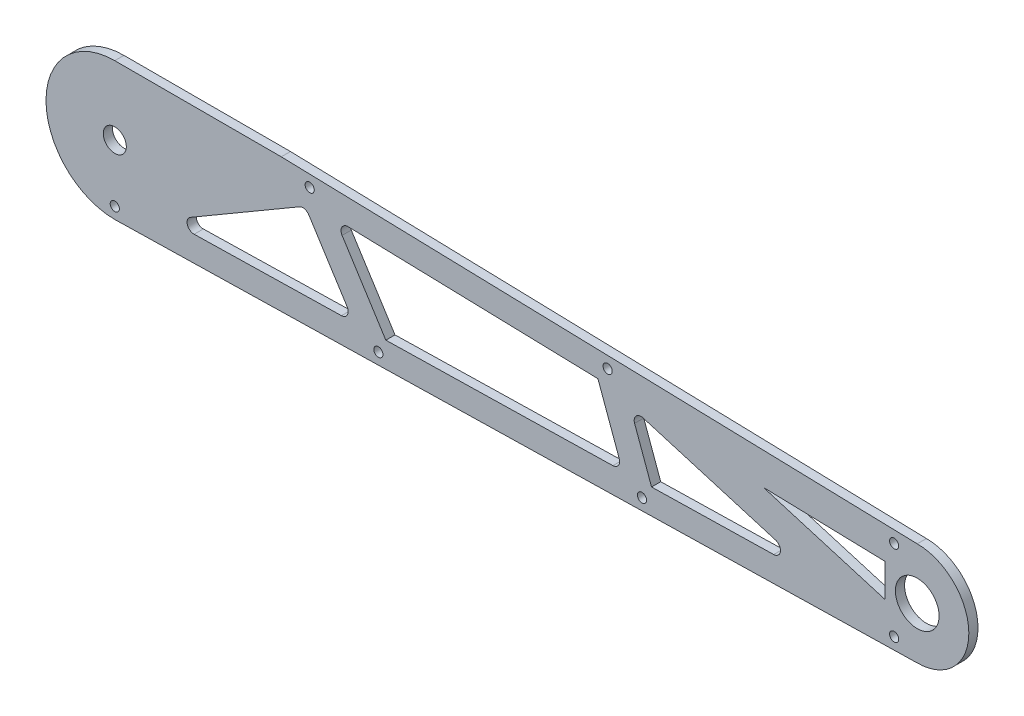
from build123d import *

# Parameters (mm, degrees)
SKETCH_1_R          = 5.03
SKETCH_1_R_2        = 9.53
SKETCH_1_R_3        = 2
EXTRUDE_1_DEPTH     = 4
CUT_EXTRUDE_1_DEPTH = 10


with BuildPart() as part:
    # 草图1 → 凸台-拉伸1 (new body)
    with BuildSketch(Plane.XY):
        with BuildLine():
            Line((348.542857143, 22.354285714), (71.15327348, 29.854285714))
            Line((71.15327348, 29.854285714), (-1.457142857, 29.854285714))
            ThreePointArc((-1.457142857, 29.854285714), (-31.457142857, -0.145714286), (-1.457142857, -30.145714286))
            Line((-1.457142857, -30.145714286), (348.542857143, -22.645714286))
            ThreePointArc((348.542857143, -22.645714286), (371.042857143, -0.145714286), (348.542857143, 22.354285714))
        make_face()
        with Locations((-1.457142857, -0.145714286)):
            Circle(SKETCH_1_R, mode=Mode.SUBTRACT)
        with Locations((348.542857143, -0.145714286)):
            Circle(SKETCH_1_R_2, mode=Mode.SUBTRACT)
        with Locations((-1.457142857, -25.145714286)):
            Circle(SKETCH_1_R_3, mode=Mode.SUBTRACT)
        with Locations((83.558658591, 24.490381358)):
            Circle(SKETCH_1_R_3, mode=Mode.SUBTRACT)
        with Locations((213.511166909, 20.976753342)):
            Circle(SKETCH_1_R_3, mode=Mode.SUBTRACT)
        with Locations(Location((228.490069199, -20.218274027, 0), (0, 0, 180))):
            Circle(SKETCH_1_R_3, mode=Mode.SUBTRACT)
        with Locations(Location((113.516463171, -22.681994157, 0), (0, 0, 180))):
            Circle(SKETCH_1_R_3, mode=Mode.SUBTRACT)
        with Locations((338.463675227, -17.754553898)):
            Circle(SKETCH_1_R_3, mode=Mode.SUBTRACT)
        with Locations((338.463675227, 17.463125327)):
            Circle(SKETCH_1_R_3, mode=Mode.SUBTRACT)
    extrude(amount=EXTRUDE_1_DEPTH)

    # 草图4 → 切除-拉伸1 (cut)
    with BuildSketch(Plane(origin=(0, 0, 0), x_dir=(-1, 0, 0), z_dir=(0, 0, -1))):
        with BuildLine():
            Line((-79.096608398, 14.937462311), (-31.566415003, -12.812828637))
            ThreePointArc((-31.566415003, -12.812828637), (-30.191694318, -16.218057795), (-33.143289006, -18.402899067))
            Line((-33.143289006, -18.402899067), (-97.422136429, -17.025495194))
            ThreePointArc((-97.422136429, -17.025495194), (-100.002344972, -15.442774062), (-99.890331665, -12.41788806))
            Line((-99.890331665, -12.41788806), (-83.141677637, 13.954999014))
            ThreePointArc((-83.141677637, 13.954999014), (-81.317264225, 15.261949688), (-79.096608398, 14.937462311))
        make_face()
        with BuildLine():
            Line((-116.768601629, -16.610928082), (-215.80395994, -14.488741833))
            ThreePointArc((-215.80395994, -14.488741833), (-218.215167386, -13.18412995), (-218.559093597, -10.464268138))
            Line((-218.559093597, -10.464268138), (-209.267574838, 15.089297949))
            Line((-209.267574838, 15.089297949), (-100.305174274, 18.035399938))
            ThreePointArc((-100.305174274, 18.035399938), (-97.614705316, 16.516735307), (-97.691624355, 13.428200228))
            Line((-97.691624355, 13.428200228), (-116.768601629, -16.610928082))
        make_face()
        with BuildLine():
            Line((-232.659749539, -14.127546341), (-285.953651799, -12.98553415))
            ThreePointArc((-285.953651799, -12.98553415), (-288.86244016, -10.38736889), (-286.746258648, -7.111199137))
            Line((-286.746258648, -7.111199137), (-228.938261452, 10.118012745))
            ThreePointArc((-228.938261452, 10.118012745), (-225.898326118, 9.300720915), (-225.261979027, 6.217826959))
            Line((-225.261979027, 6.217826959), (-232.659749539, -14.127546341))
        make_face()
        Polygon((-334.463675227, -5.68094836), (-281.386552555, 10.138264153), (-334.463675227, 8.703176307), align=None)
    extrude(amount=-CUT_EXTRUDE_1_DEPTH, mode=Mode.SUBTRACT)


solid = part.part
